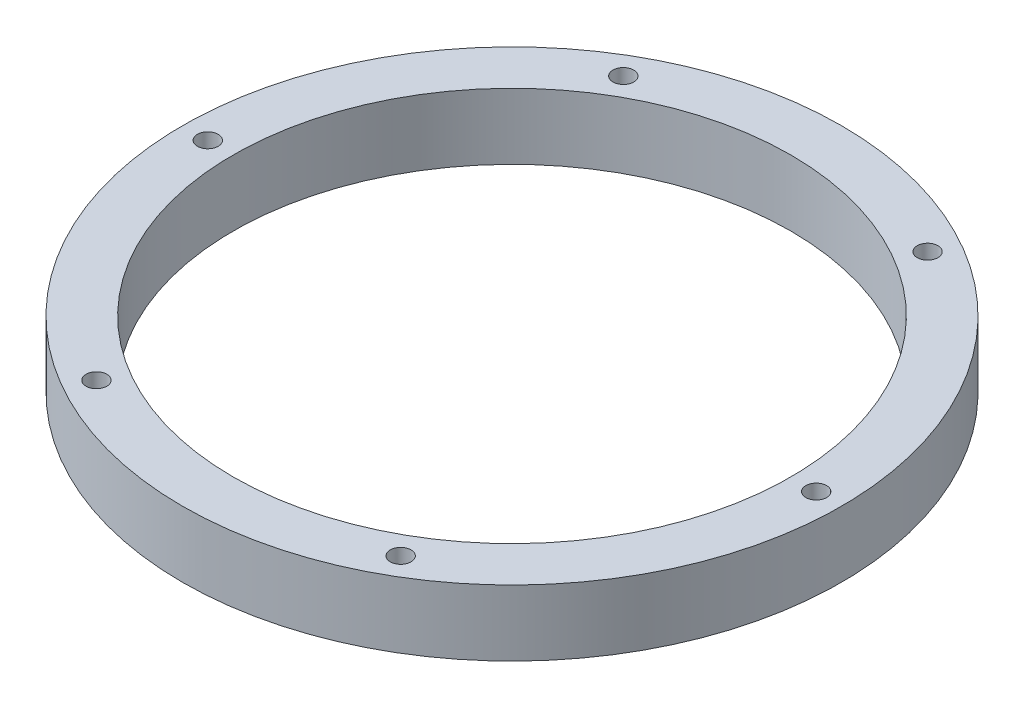
from build123d import *

# Parameters (mm, degrees)
SKETCH_1_R      = 65
SKETCH_1_R_2    = 55
SKETCH_1_R_3    = 2.05
EXTRUDE_1_DEPTH = 13


with BuildPart() as part:
    # 草图1 → 凸台-拉伸1 (new body)
    with BuildSketch(Plane(origin=(0, 0, 0), x_dir=(1, 0, 0), z_dir=(0, 1, 0))):
        with Locations(Location((0, 0, 0), (0, 0, 90))):
            Circle(SKETCH_1_R)
        with Locations(Location((0, 0, 0), (0, 0, 90))):
            Circle(SKETCH_1_R_2, mode=Mode.SUBTRACT)
        with Locations(Location((60, 0, 0), (0, 0, 90))):
            Circle(SKETCH_1_R_3, mode=Mode.SUBTRACT)
        with Locations(Location((30, -51.961524227, 0), (0, 0, 90))):
            Circle(SKETCH_1_R_3, mode=Mode.SUBTRACT)
        with Locations(Location((-30, -51.961524227, 0), (0, 0, 90))):
            Circle(SKETCH_1_R_3, mode=Mode.SUBTRACT)
        with Locations(Location((-60, 0, 0), (0, 0, 90))):
            Circle(SKETCH_1_R_3, mode=Mode.SUBTRACT)
        with Locations(Location((-30, 51.961524227, 0), (0, 0, 90))):
            Circle(SKETCH_1_R_3, mode=Mode.SUBTRACT)
        with Locations(Location((30, 51.961524227, 0), (0, 0, 90))):
            Circle(SKETCH_1_R_3, mode=Mode.SUBTRACT)
    extrude(amount=EXTRUDE_1_DEPTH)


solid = part.part
